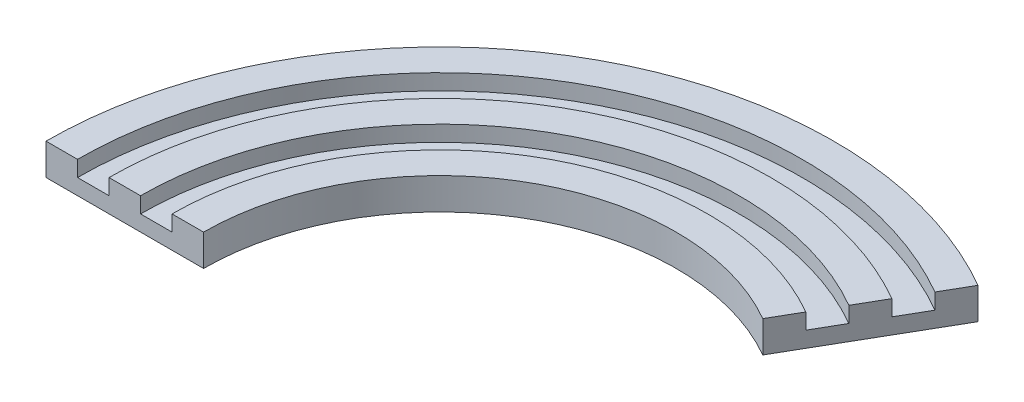
from build123d import *


with BuildPart() as part:
    # Sweep1: sweep along a path in Sketch2
    with BuildLine(Plane(origin=(0, 0, 0), x_dir=(1, 0, 0), z_dir=(0, 1, 0))) as sweep1_path:
        ThreePointArc((0, 0), (50, 86.602540378), (150, 86.602540378))
    # Sketch1 → Sweep1 (sweep)
    with BuildSketch(Plane.XY):
        Polygon((25, -5), (-25, -5), (-25, 5), (-15, 5), (-15, 0), (-5, 0), (-5, 5), (5, 5), (5, 0), (15, 0), (15, 5), (25, 5), align=None)
    sweep(path=sweep1_path.line)


solid = part.part
